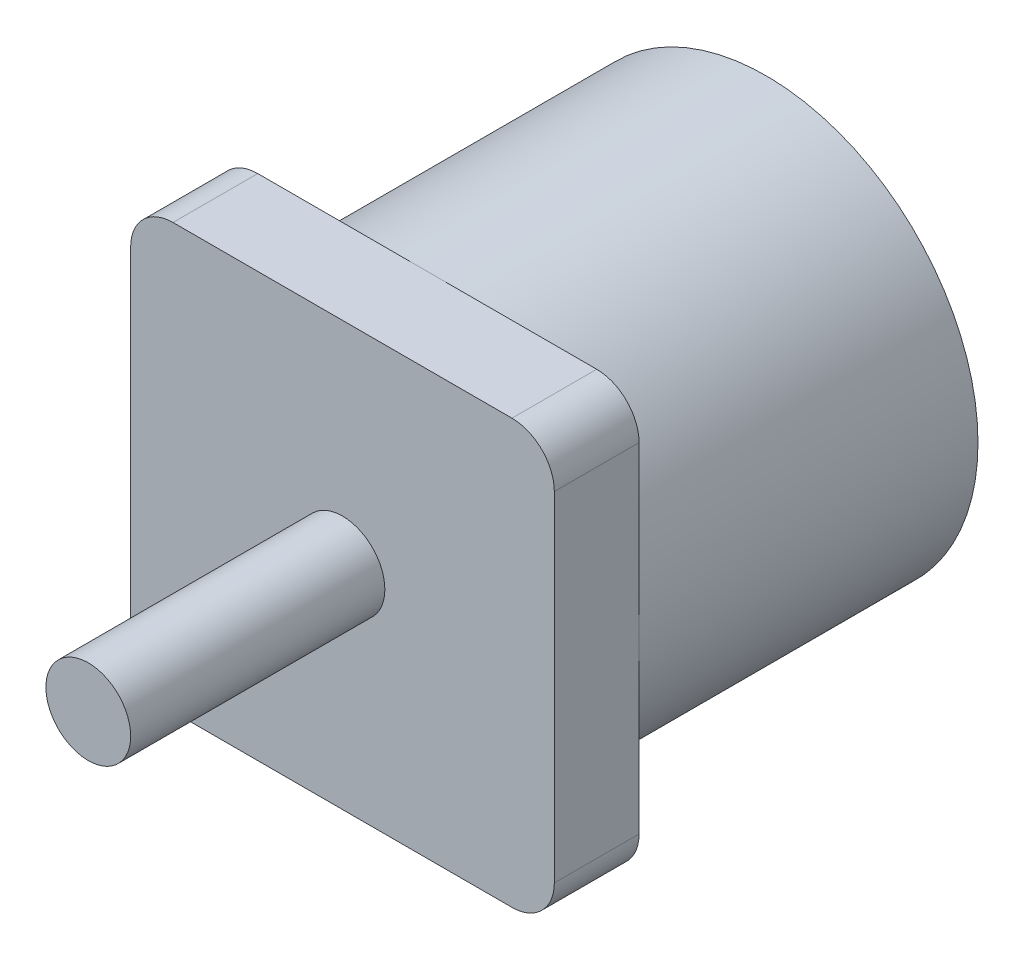
from build123d import *

# Parameters (mm, degrees)
SKETCH1_R           = 25
BOSS_EXTRUDE1_DEPTH = 50
SKETCH2_R           = 5
BOSS_EXTRUDE2_DEPTH = 30
SKETCH3_W           = 50
SKETCH3_H           = 50
BOSS_EXTRUDE3_DEPTH = 10
FILLET1_R           = 5


with BuildPart() as part:
    # Sketch1 → Boss-Extrude1 (new body)
    with BuildSketch(Plane.XY):
        Circle(SKETCH1_R)
    extrude(amount=BOSS_EXTRUDE1_DEPTH)

    # Sketch2 → Boss-Extrude2 (add)
    with BuildSketch(Plane.XY.offset(50)):
        Circle(SKETCH2_R)
    extrude(amount=BOSS_EXTRUDE2_DEPTH)

    # Sketch3 → Boss-Extrude3 (add)
    with BuildSketch(Plane.XY.offset(50)):
        Rectangle(SKETCH3_W, SKETCH3_H)
    extrude(amount=-BOSS_EXTRUDE3_DEPTH)

    # Fillet1
    fillet1_edges = [part.edges().sort_by_distance(p)[0] for p in [
        (25, 25, 45),
        (25, -25, 45),
        (-25, -25, 45),
        (-25, 25, 45),
    ]]
    fillet(fillet1_edges, radius=FILLET1_R)


solid = part.part
